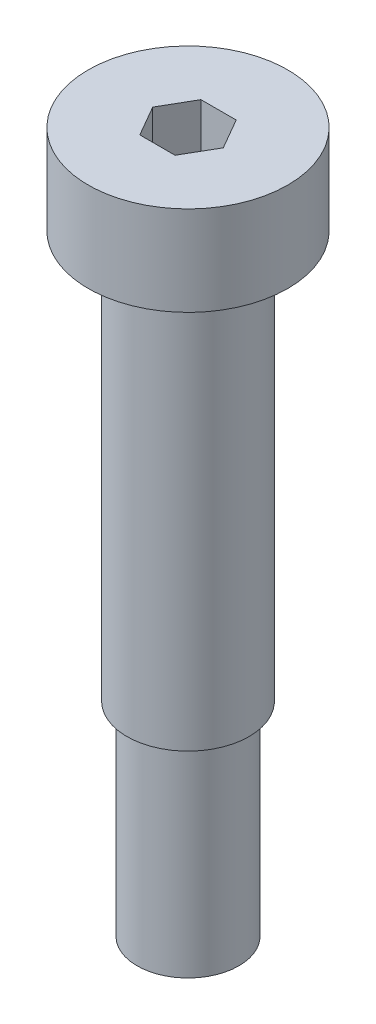
from build123d import *

# Parameters (mm, degrees)
CUT_EXTRUDE_1_DEPTH = 3


with BuildPart() as part:
    # 草图1 → 旋转1 (revolve)
    with BuildSketch(Plane.XY):
        Polygon((0, 0), (0, 34.4), (4.9, 34.4), (4.9, 30), (3, 30), (3, 10), (2.5, 10), (2.5, 0), align=None)
    revolve(axis=Axis((0, 0, 0), (0, 1, 0)))

    # 草图2 → 切除-拉伸1 (cut)
    with BuildSketch(Plane(origin=(0, 34.4, 0), x_dir=(1, 0, 0), z_dir=(0, 1, 0))):
        Polygon((1.732050808, 0), (0.866025404, 1.5), (-0.866025404, 1.5), (-1.732050808, 0), (-0.866025404, -1.5), (0.866025404, -1.5), align=None)
    extrude(amount=-CUT_EXTRUDE_1_DEPTH, mode=Mode.SUBTRACT)


solid = part.part
